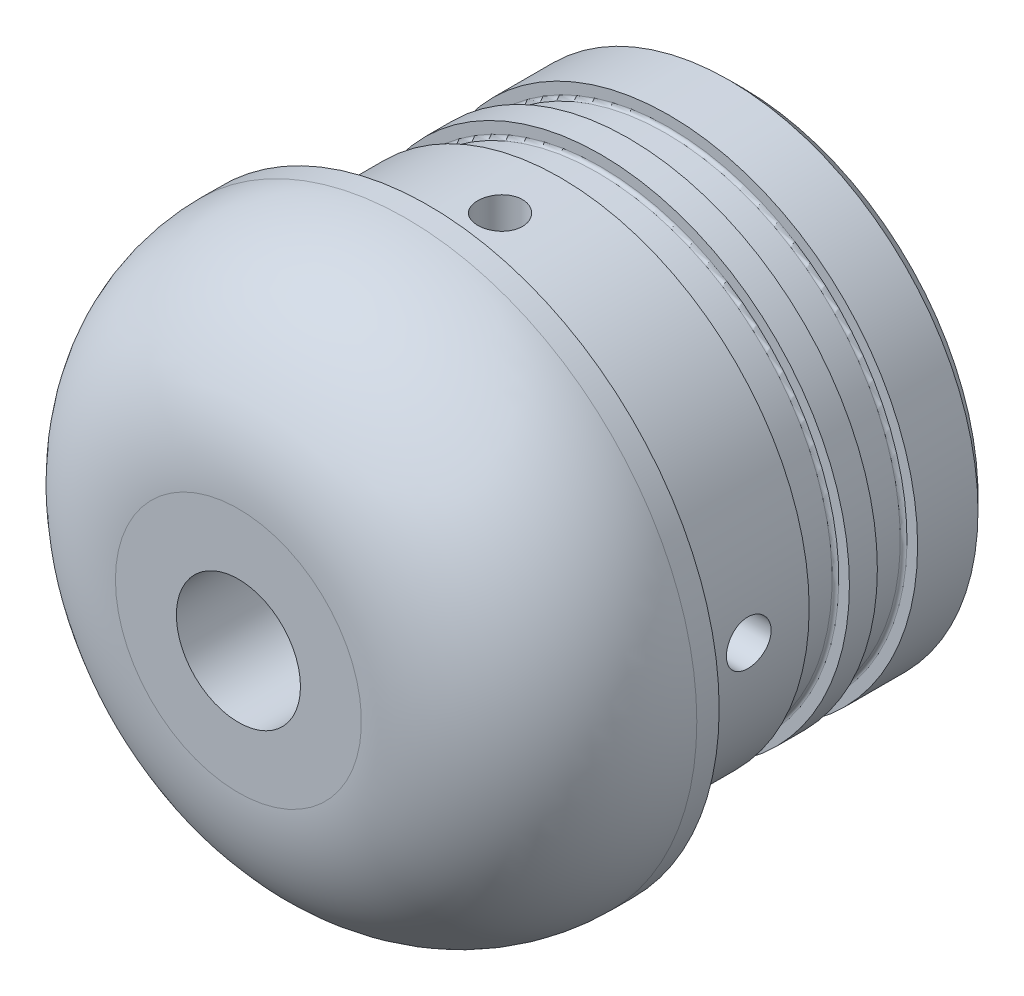
from build123d import *

# Parameters (mm, degrees)
BOSS_EXTRUDE1_START = 2
SKETCH3_R           = 26
SKETCH3_R_2         = 12.25
BOSS_EXTRUDE1_DEPTH = 2
SKETCH11_R          = 12.25
BOSS_EXTRUDE2_DEPTH = 13
SKETCH12_R          = 5.55
CUT_EXTRUDE7_DEPTH  = 28
SKETCH6_R           = 2
CUT_EXTRUDE4_DEPTH  = 6
SKETCH9_R           = 16.5
CUT_EXTRUDE6_DEPTH  = 17.1
CHAMFER1_SIZE       = 4
FILLET1_R           = 0.3
CIRPATTERN1_COUNT   = 4
SKETCH13_R          = 18
CUT_EXTRUDE8_DEPTH  = 17.1
CHAMFER3_SIZE       = 4
SKETCH14_R          = 19
CUT_EXTRUDE9_DEPTH  = 1.6


with BuildPart() as part:
    # Sketch1 → Revolve1 (revolve)
    with BuildSketch(Plane(origin=(0, 0, 0), x_dir=(0, 0, -1), z_dir=(1, 0, 0)), mode=Mode.PRIVATE) as revolve1_sk:
        Polygon((-28.1, 16.231420233), (-28.1, 22.25), (-16.3, 22.25), (-16.3, 21), (-12.7, 21), (-12.7, 22.25), (-10.2, 22.25), (-10.2, 21), (-6.6, 21), (-6.6, 22.25), (-1.2, 22.25), (0, 21.05), (0, 12.25), (-28.1, 12.25), align=None)
    revolve(revolve1_sk.sketch.rotate(Axis((0, 0, 36.316050584), (0, 0, -1)), 180), axis=Axis((0, 0, 36.316050584), (0, 0, -1)))

    # Sketch3 → Boss-Extrude1 (add)
    with BuildSketch(Plane.XY.offset(28.1).offset(BOSS_EXTRUDE1_START)):
        Circle(SKETCH3_R)
        with Locations(Location((0, 0, 0), (0, 0, 270))):
            Circle(SKETCH3_R_2, mode=Mode.SUBTRACT)
    extrude(amount=-BOSS_EXTRUDE1_DEPTH)

    # Sketch4 → Revolve9 (revolve)
    with BuildSketch(Plane(origin=(0, 0, 0), x_dir=(1, 0, 0), z_dir=(0, 1, 0)), mode=Mode.PRIVATE) as revolve9_sk:
        with BuildLine():
            Line((0, -45.1), (0, -30.1))
            Line((0, -30.1), (-26, -30.1))
            ThreePointArc((-26, -30.1), (-21.606601718, -40.706601718), (-11, -45.1))
            Line((-11, -45.1), (0, -45.1))
        make_face()
    revolve(revolve9_sk.sketch.rotate(Axis((0, 0, 0), (0, 0, 1)), 90), axis=Axis((0, 0, 0), (0, 0, 1)))

    # Sketch11 → Boss-Extrude2 (add)
    with BuildSketch(Plane(origin=(0, 0, 30.1), x_dir=(-1, 0, 0), z_dir=(0, 0, -1))):
        with Locations(Location((0, 0, 0), (0, 0, 270))):
            Circle(SKETCH11_R)
    extrude(amount=BOSS_EXTRUDE2_DEPTH)

    # Sketch12 → Cut-Extrude7 (cut)
    with BuildSketch(Plane.XY.offset(45.1)):
        Circle(SKETCH12_R)
    extrude(amount=-CUT_EXTRUDE7_DEPTH, mode=Mode.SUBTRACT)

    # Sketch6 → Cut-Extrude4 (cut)
    with BuildSketch(Plane(origin=(22.25, 0, 0), x_dir=(0, 0, -1), z_dir=(1, 0, 0))):
        with Locations((-21.7, 0)):
            Circle(SKETCH6_R)
    cut_extrude4 = extrude(amount=-CUT_EXTRUDE4_DEPTH, mode=Mode.SUBTRACT)

    # Sketch9 → Cut-Extrude6 (cut)
    with BuildSketch(Plane(origin=(0, 0, 0), x_dir=(-1, 0, 0), z_dir=(0, 0, -1))):
        with Locations(Location((0, 0, 0), (0, 0, 90))):
            Circle(SKETCH9_R)
    extrude(amount=-CUT_EXTRUDE6_DEPTH, mode=Mode.SUBTRACT)

    # Chamfer1
    chamfer1_edges = [part.edges().sort_by_distance(p)[0] for p in [
        (-5.55, 0, 17.1),
        (0, -16.5, 17.1),
    ]]
    chamfer(chamfer1_edges, length=CHAMFER1_SIZE)

    # Fillet1
    fillet1_edges = [part.edges().sort_by_distance(p)[0] for p in [
        (0, 21, 6.6),
        (0, 21, 10.2),
        (0, 21, 12.7),
        (0, 21, 16.3),
    ]]
    fillet(fillet1_edges, radius=FILLET1_R)

    # CirPattern1: Cut-Extrude4 ×4 about axis
    cirpattern1_axis = Axis((0, 0, 0), (0, 0, 1))
    for i in range(1, CIRPATTERN1_COUNT):
        add(cut_extrude4.rotate(cirpattern1_axis, i * 360 / CIRPATTERN1_COUNT), mode=Mode.SUBTRACT)

    # Sketch13 → Cut-Extrude8 (cut)
    with BuildSketch(Plane(origin=(0, 0, 0), x_dir=(-1, 0, 0), z_dir=(0, 0, -1))):
        with Locations(Location((0, 0, 0), (0, 0, 90))):
            Circle(SKETCH13_R)
    extrude(amount=-CUT_EXTRUDE8_DEPTH, mode=Mode.SUBTRACT)

    # Chamfer3
    chamfer3_edges = [part.edges().sort_by_distance(p)[0] for p in [
        (0, -18, 17.1),
    ]]
    chamfer(chamfer3_edges, length=CHAMFER3_SIZE)

    # Sketch14 → Cut-Extrude9 (cut)
    with BuildSketch(Plane(origin=(0, 0, 2.5), x_dir=(-1, 0, 0), z_dir=(0, 0, -1))):
        with Locations(Location((0, 0, 0), (0, 0, 90))):
            Circle(SKETCH14_R)
    extrude(amount=-CUT_EXTRUDE9_DEPTH, mode=Mode.SUBTRACT)


solid = part.part
